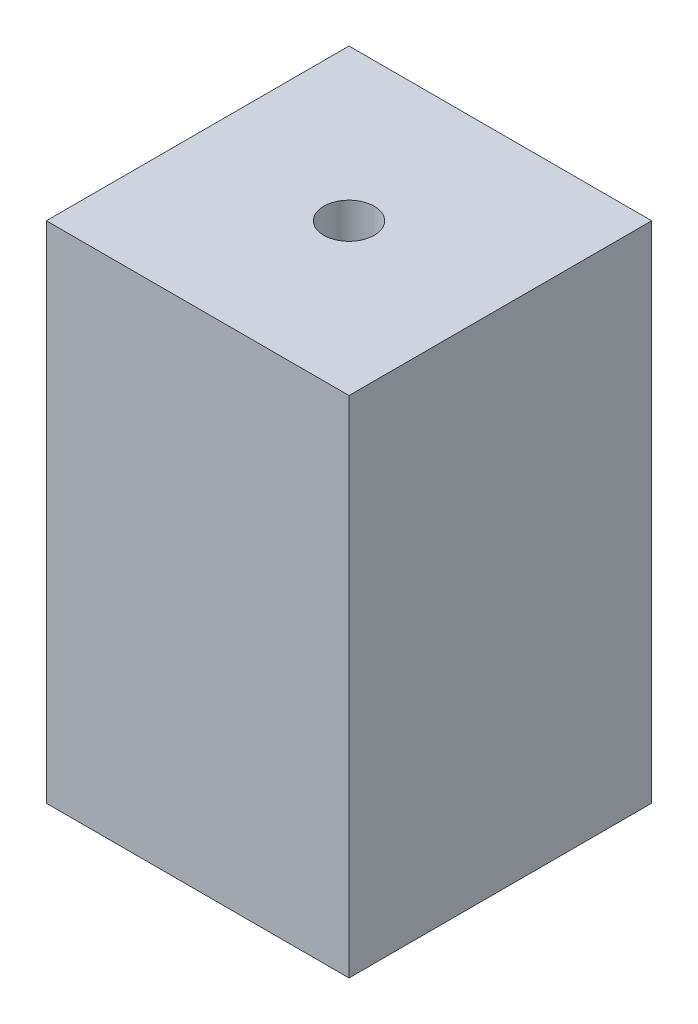
from build123d import *

# Parameters (mm, degrees)
SKETCH1_W           = 30
SKETCH1_H           = 30
BOSS_EXTRUDE1_DEPTH = 50
SKETCH2_R           = 2.5
CUT_EXTRUDE1_DEPTH  = 10


with BuildPart() as part:
    # Sketch1 → Boss-Extrude1 (new body)
    with BuildSketch(Plane(origin=(0, 0, 0), x_dir=(1, 0, 0), z_dir=(0, 1, 0))):
        Rectangle(SKETCH1_W, SKETCH1_H)
    extrude(amount=BOSS_EXTRUDE1_DEPTH)

    # Sketch2 → Cut-Extrude1 (cut)
    with BuildSketch(Plane(origin=(0, 50, 0), x_dir=(1, 0, 0), z_dir=(0, 1, 0))):
        with Locations(Location((0, 0, 0), (0, 0, 270))):
            Circle(SKETCH2_R)
    extrude(amount=-CUT_EXTRUDE1_DEPTH, mode=Mode.SUBTRACT)


solid = part.part
